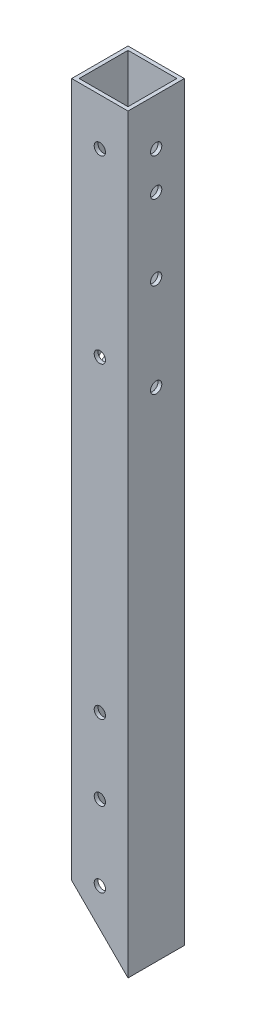
from build123d import *

# Parameters (mm, degrees)
SKETCH_1_W          = 15
SKETCH_1_H          = 15
SKETCH_1_W_2        = 13
SKETCH_1_H_2        = 13
EXTRUDE_1_DEPTH     = 200
SKETCH_2_R          = 1.5
CUT_EXTRUDE_1_DEPTH = 201.701893364
SKETCH_3_R          = 1.5
CUT_EXTRUDE_2_DEPTH = 201.701893364


with BuildPart() as part:
    # 草图1 → 凸台-拉伸1 (new body)
    with BuildSketch(Plane(origin=(0, 0, 0), x_dir=(1, 0, 0), z_dir=(0, 1, 0))):
        Rectangle(SKETCH_1_W, SKETCH_1_H)
        Rectangle(SKETCH_1_W_2, SKETCH_1_H_2, mode=Mode.SUBTRACT)
    extrude(amount=EXTRUDE_1_DEPTH)

    # 草图2 → 切除-拉伸1 (cut, through all)
    with BuildSketch(Plane.XY.offset(7.5)):
        with Locations((0, 37.5)):
            Circle(SKETCH_2_R)
        with Locations((0, 17.5)):
            Circle(SKETCH_2_R)
        with Locations((0, 57.5)):
            Circle(SKETCH_2_R)
        with Locations((0, 187.5)):
            Circle(SKETCH_2_R)
        with Locations((0, 139.5)):
            Circle(SKETCH_2_R)
        Polygon((7.5, 0), (-7.5, 0), (-7.5, 15), align=None)
    extrude(amount=-CUT_EXTRUDE_1_DEPTH, mode=Mode.SUBTRACT)

    # 草图3 → 切除-拉伸2 (cut, through all)
    with BuildSketch(Plane(origin=(7.5, 0, 0), x_dir=(0, 0, -1), z_dir=(1, 0, 0))):
        with Locations((0, 157.5)):
            Circle(SKETCH_3_R)
        with Locations((0, 177.5)):
            Circle(SKETCH_3_R)
        with Locations((0, 132.5)):
            Circle(SKETCH_3_R)
        with Locations((0, 187.5)):
            Circle(SKETCH_3_R)
    extrude(amount=-CUT_EXTRUDE_2_DEPTH, mode=Mode.SUBTRACT)


solid = part.part
